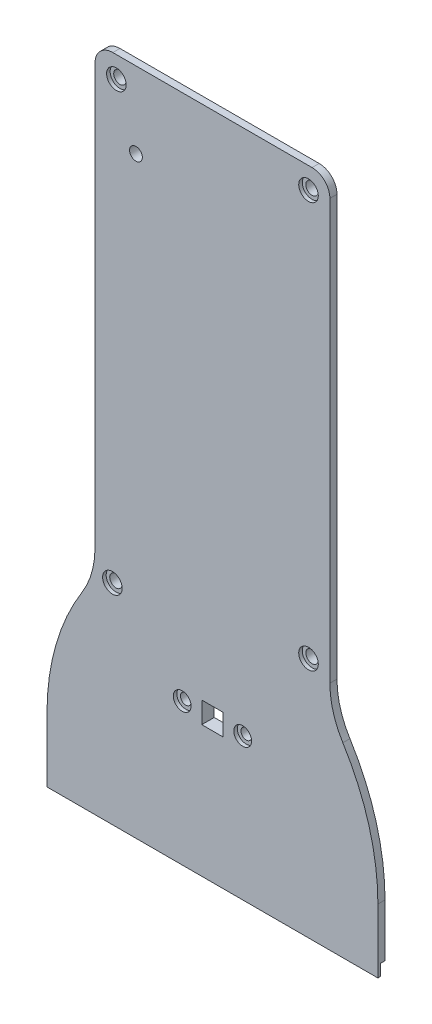
from build123d import *

# Parameters (mm, degrees)
BOSS_EXTRUDE1_DEPTH = 1.5
BOSS_EXTRUDE2_DEPTH = 2
SKETCH3_W           = 1.2
SKETCH3_H           = 3.2
CUT_EXTRUDE1_DEPTH  = 210.759497368
SKETCH4_R           = 1.75
SKETCH4_R_2         = 1.5
SKETCH4_W           = 6
SKETCH4_H           = 6
CUT_EXTRUDE2_DEPTH  = 194.70221149
SKETCH5_R           = 2.75
SKETCH5_R_2         = 2.5
CUT_EXTRUDE3_DEPTH  = 1
SKETCH6_R           = 1.8
CUT_EXTRUDE4_DEPTH  = 194.70221149


with BuildPart() as part:
    # Sketch1 → Boss-Extrude1 (new body)
    with BuildSketch(Plane.XY):
        with BuildLine():
            Line((-43.5, 3.5), (-43.5, 18))
            ThreePointArc((-43.5, 18), (-41.102679313, 35.031824172), (-34.097009983, 50.740127019))
            ThreePointArc((-34.097009983, 50.740127019), (-30.928959041, 57.572199931), (-29.55199189, 64.976099479))
            Line((-29.55199189, 64.976099479), (-29.5, 65.005443368))
            Line((-29.5, 65.005443368), (-29.5, 184.505443368))
            Line((-29.5, 184.505443368), (29.5, 184.505443368))
            Line((29.5, 184.505443368), (29.5, 65.005443368))
            Line((29.5, 65.005443368), (29.55199189, 64.976099479))
            ThreePointArc((29.55199189, 64.976099479), (30.928959041, 57.572199931), (34.097009983, 50.740127019))
            ThreePointArc((34.097009983, 50.740127019), (41.102679313, 35.031824172), (43.5, 18))
            Line((43.5, 18), (43.5, 3.5))
            Line((43.5, 3.5), (-43.5, 3.5))
        make_face()
    extrude(amount=-BOSS_EXTRUDE1_DEPTH)

    # Sketch2 → Boss-Extrude2 (add)
    with BuildSketch(Plane.XY):
        with BuildLine():
            Line((-46.5, 3), (-46.5, 18))
            ThreePointArc((-46.5, 18), (-43.986116227, 35.859949502), (-36.639815607, 52.332025117))
            ThreePointArc((-36.639815607, 52.332025117), (-33.927981976, 58.412572449), (-33, 65.005443368))
            Line((-33, 65.005443368), (-33, 183.005443368))
            ThreePointArc((-33, 183.005443368), (-31.535533906, 186.540977274), (-28, 188.005443368))
            Line((-28, 188.005443368), (28, 188.005443368))
            ThreePointArc((28, 188.005443368), (31.535533906, 186.540977274), (33, 183.005443368))
            Line((33, 183.005443368), (33, 65.005443368))
            ThreePointArc((33, 65.005443368), (33.927981976, 58.412572449), (36.639815607, 52.332025117))
            ThreePointArc((36.639815607, 52.332025117), (43.986116227, 35.859949502), (46.5, 18))
            Line((46.5, 18), (46.5, 3))
            Line((46.5, 3), (46.5, 0))
            Line((46.5, 0), (-46.5, 0))
            Line((-46.5, 0), (-46.5, 3))
        make_face()
    extrude(amount=BOSS_EXTRUDE2_DEPTH)

    # Sketch3 → Cut-Extrude1 (cut, through all)
    with BuildSketch(Plane.ZY.offset(46.5)):
        with Locations((0.6, 1.6)):
            Rectangle(SKETCH3_W, SKETCH3_H)
    extrude(amount=-CUT_EXTRUDE1_DEPTH, mode=Mode.SUBTRACT)

    # Sketch4 → Cut-Extrude2 (cut, through all)
    with BuildSketch(Plane.XY.offset(2)):
        with Locations((-27, 182.005443368)):
            Circle(SKETCH4_R)
        with Locations((27, 182.005443368)):
            Circle(SKETCH4_R)
        with Locations((-28.117843442, 58.880926182)):
            Circle(SKETCH4_R)
        with Locations((27, 68.005443368)):
            Circle(SKETCH4_R)
        with Locations((-8.5, 39.912117831)):
            Circle(SKETCH4_R_2)
        with Locations((8.5, 39.912117831)):
            Circle(SKETCH4_R_2)
        with Locations((0, 39.912117831)):
            Rectangle(SKETCH4_W, SKETCH4_H)
    extrude(amount=-CUT_EXTRUDE2_DEPTH, mode=Mode.SUBTRACT)

    # Sketch5 → Cut-Extrude3 (cut)
    with BuildSketch(Plane.XY.offset(2)):
        with Locations((27, 182.005443368)):
            Circle(SKETCH5_R)
        with Locations((-27, 182.005443368)):
            Circle(SKETCH5_R)
        with Locations((-28.117843442, 58.880926182)):
            Circle(SKETCH5_R)
        with Locations((-8.5, 39.912117831)):
            Circle(SKETCH5_R_2)
        with Locations((8.5, 39.912117831)):
            Circle(SKETCH5_R_2)
        with Locations((27, 68.005443368)):
            Circle(SKETCH5_R)
    extrude(amount=-CUT_EXTRUDE3_DEPTH, mode=Mode.SUBTRACT)

    # Sketch6 → Cut-Extrude4 (cut, through all)
    with BuildSketch(Plane.XY.offset(2)):
        with Locations((-21.5, 166.615388867)):
            Circle(SKETCH6_R)
    extrude(amount=-CUT_EXTRUDE4_DEPTH, mode=Mode.SUBTRACT)


solid = part.part
